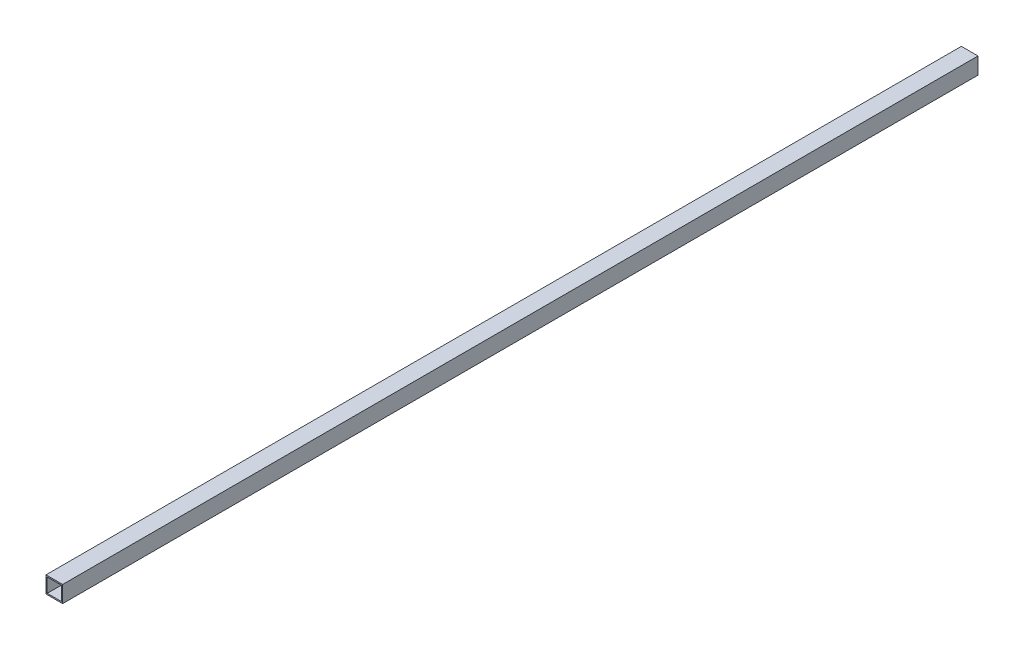
from build123d import *

# Parameters (mm, degrees)
SKETCH1_W           = 40
SKETCH1_H           = 40
BOSS_EXTRUDE1_DEPTH = 2200
SKETCH2_W           = 34
SKETCH2_H           = 34
CUT_EXTRUDE1_DEPTH  = 2200


with BuildPart() as part:
    # Sketch1 → Boss-Extrude1 (new body)
    with BuildSketch(Plane.XY):
        Rectangle(SKETCH1_W, SKETCH1_H)
    extrude(amount=BOSS_EXTRUDE1_DEPTH)

    # Sketch2 → Cut-Extrude1 (cut)
    with BuildSketch(Plane(origin=(0, 0, 0), x_dir=(-1, 0, 0), z_dir=(0, 0, -1))):
        Rectangle(SKETCH2_W, SKETCH2_H)
    extrude(amount=-CUT_EXTRUDE1_DEPTH, mode=Mode.SUBTRACT)


solid = part.part
